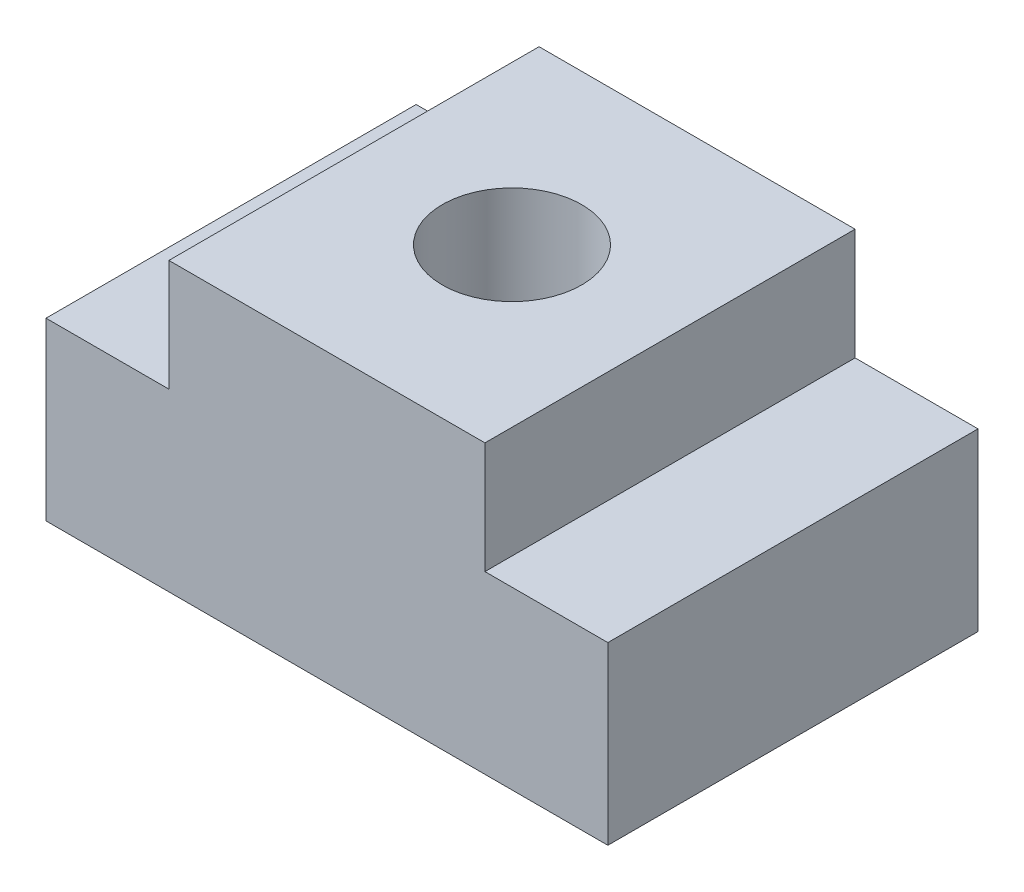
from build123d import *

# Parameters (mm, degrees)
BOSS_EXTRUDE1_DEPTH     = 21.082
F_3_8_16_TAPPED_HOLE1_D = 7.9375


with BuildPart() as part:
    # Sketch1 → Boss-Extrude1 (new body)
    with BuildSketch(Plane.XY):
        Polygon((-16, 0), (16, 0), (16, 10), (9, 10), (9, 16.35), (-9, 16.35), (-9, 10), (-16, 10), align=None)
    extrude(amount=BOSS_EXTRUDE1_DEPTH)

    # 3/8-16 Tapped Hole1 (through all)
    with Locations(Plane(origin=(0, 16.35, 0), x_dir=(1, 0, 0), z_dir=(0, 1, 0))):
        with Locations((0, -10.541)):
            Hole(F_3_8_16_TAPPED_HOLE1_D / 2)


solid = part.part
